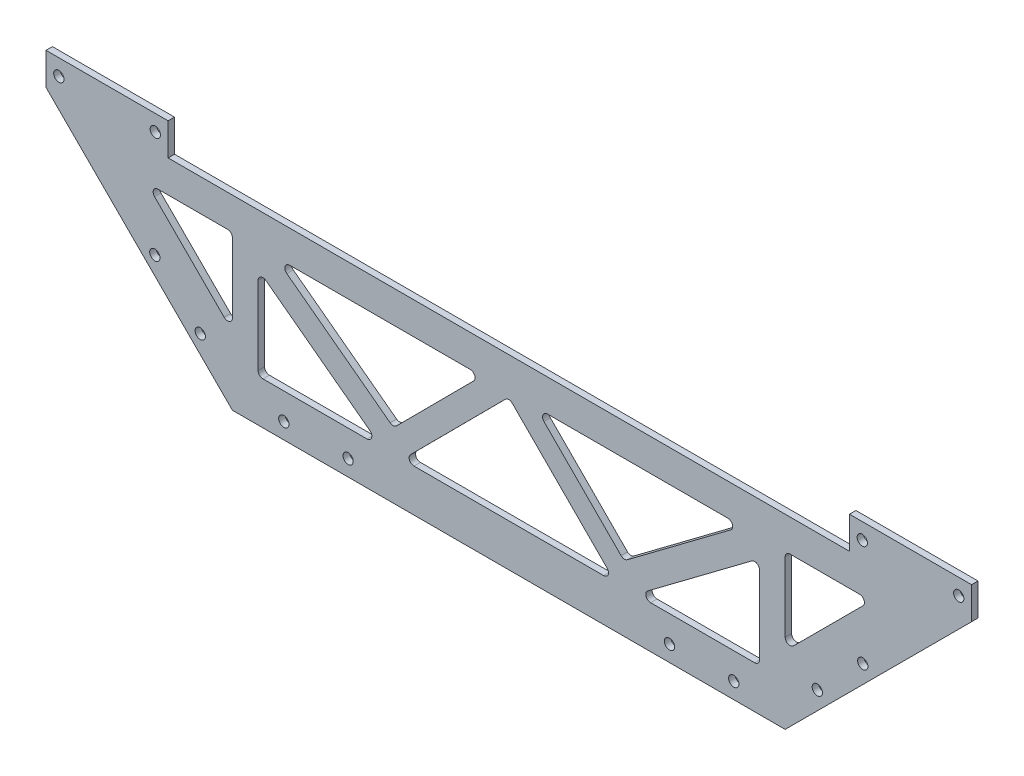
from build123d import *

# Parameters (mm, degrees)
SKETCH_1_R               = 1.6
EXTRUDE_1_DEPTH          = 2
SKETCH_2_R               = 1.6
CUT_EXTRUDE_1_DEPTH      = 156.254629561
SKETCH_3_W               = 288
SKETCH_3_H               = 20
CUT_EXTRUDE_2_DEPTH      = 156.254629561
CUT_EXTRUDE_3_DEPTH      = 156.254629561
CUT_EXTRUDE_3_DEPTH_BACK = 156.254629561


with BuildPart() as part:
    # 草图1 → 凸台-拉伸1 (new body)
    with BuildSketch(Plane.XY):
        Polygon((-106, 30), (-106, 0), (106, 0), (106, 30), (144, 30), (144, 0), (86, -58), (-86, -58), (-144, 0), (-144, 30), align=None)
        with Locations((-140, 25)):
            Circle(SKETCH_1_R, mode=Mode.SUBTRACT)
        with Locations((-110, 25)):
            Circle(SKETCH_1_R, mode=Mode.SUBTRACT)
        with Locations((-110, 5)):
            Circle(SKETCH_1_R, mode=Mode.SUBTRACT)
        with Locations((-140, 5)):
            Circle(SKETCH_1_R, mode=Mode.SUBTRACT)
        with Locations(Location((140, 5, 0), (0, 0, 180))):
            Circle(SKETCH_1_R, mode=Mode.SUBTRACT)
        with Locations(Location((110, 5, 0), (0, 0, 180))):
            Circle(SKETCH_1_R, mode=Mode.SUBTRACT)
        with Locations(Location((110, 25, 0), (0, 0, 180))):
            Circle(SKETCH_1_R, mode=Mode.SUBTRACT)
        with Locations(Location((140, 25, 0), (0, 0, 180))):
            Circle(SKETCH_1_R, mode=Mode.SUBTRACT)
        with Locations((-70, -53)):
            Circle(SKETCH_1_R, mode=Mode.SUBTRACT)
        with Locations((-50, -53)):
            Circle(SKETCH_1_R, mode=Mode.SUBTRACT)
        with Locations(Location((50, -53, 0), (0, 0, 180))):
            Circle(SKETCH_1_R, mode=Mode.SUBTRACT)
        with Locations(Location((70, -53, 0), (0, 0, 180))):
            Circle(SKETCH_1_R, mode=Mode.SUBTRACT)
    extrude(amount=EXTRUDE_1_DEPTH)

    # 草图2 → 切除-拉伸1 (cut, through all)
    with BuildSketch(Plane.XY.offset(2)):
        with Locations((-110.142135624, -28.201010127)):
            Circle(SKETCH_2_R)
        with Locations((-96, -42.343145751)):
            Circle(SKETCH_2_R)
        with Locations(Location((96, -42.343145751, 0), (0, 0, 180))):
            Circle(SKETCH_2_R)
        with Locations(Location((110.142135624, -28.201010127, 0), (0, 0, 180))):
            Circle(SKETCH_2_R)
    extrude(amount=-CUT_EXTRUDE_1_DEPTH, mode=Mode.SUBTRACT)

    # 草图3 → 切除-拉伸2 (cut, through all)
    with BuildSketch(Plane.XY.offset(2)):
        with Locations((0, 20)):
            Rectangle(SKETCH_3_W, SKETCH_3_H)
    extrude(amount=-CUT_EXTRUDE_2_DEPTH, mode=Mode.SUBTRACT)

    # 草图4 → 切除-拉伸3 (cut, two sides: drawn at the far end of the back side and taken through both)
    with BuildSketch(Plane.XY.offset(2).offset(-CUT_EXTRUDE_3_DEPTH_BACK)):
        with BuildLine():
            Line((-110.226136393, -12.560660172), (-88.560660172, -34.226136393))
            ThreePointArc((-88.560660172, -34.226136393), (-86.925974851, -34.55129552), (-86, -33.165476221))
            Line((-86, -33.165476221), (-86, -11.5))
            ThreePointArc((-86, -11.5), (-86.439339828, -10.439339828), (-87.5, -10))
            Line((-87.5, -10), (-109.165476221, -10))
            ThreePointArc((-109.165476221, -10), (-110.55129552, -10.925974851), (-110.226136393, -12.560660172))
        make_face()
        with BuildLine():
            Line((-78, -19), (-78, -43.286796564))
            ThreePointArc((-78, -43.286796564), (-77.560660172, -44.347456736), (-76.5, -44.786796564))
            Line((-76.5, -44.786796564), (-44.117604581, -44.786796564))
            ThreePointArc((-44.117604581, -44.786796564), (-42.694579634, -43.761138213), (-43.217604581, -42.086796564))
            Line((-43.217604581, -42.086796564), (-75.6, -17.8))
            ThreePointArc((-75.6, -17.8), (-77.170820393, -17.658359214), (-78, -19))
        make_face()
        with BuildLine():
            Line((-68.166666667, -10), (-12, -10))
            ThreePointArc((-12, -10), (-10.614927355, -10.924175575), (-10.936588454, -12.557901642))
            Line((-10.936588454, -12.557901642), (-34.936588454, -36.682901642))
            ThreePointArc((-34.936588454, -36.682901642), (-35.891723413, -37.121086956), (-36.9, -36.825))
            Line((-36.9, -36.825), (-69.066666667, -12.7))
            ThreePointArc((-69.066666667, -12.7), (-69.589691614, -11.025658351), (-68.166666667, -10))
        make_face()
        with BuildLine():
            Line((36.9, -36.825), (69.066666667, -12.7))
            ThreePointArc((69.066666667, -12.7), (69.589691614, -11.025658351), (68.166666667, -10))
            Line((68.166666667, -10), (12, -10))
            ThreePointArc((12, -10), (10.614927355, -10.924175575), (10.936588454, -12.557901642))
            Line((10.936588454, -12.557901642), (34.936588454, -36.682901642))
            ThreePointArc((34.936588454, -36.682901642), (35.891723413, -37.121086956), (36.9, -36.825))
        make_face()
        with BuildLine():
            Line((43.217604581, -42.086796564), (75.6, -17.8))
            ThreePointArc((75.6, -17.8), (77.170820393, -17.658359214), (78, -19))
            Line((78, -19), (78, -43.286796564))
            ThreePointArc((78, -43.286796564), (77.560660172, -44.347456736), (76.5, -44.786796564))
            Line((76.5, -44.786796564), (44.117604581, -44.786796564))
            ThreePointArc((44.117604581, -44.786796564), (42.694579634, -43.761138213), (43.217604581, -42.086796564))
        make_face()
        with BuildLine():
            Line((87.5, -10), (109.165476221, -10))
            ThreePointArc((109.165476221, -10), (110.55129552, -10.925974851), (110.226136393, -12.560660172))
            Line((110.226136393, -12.560660172), (88.560660172, -34.226136393))
            ThreePointArc((88.560660172, -34.226136393), (86.925974851, -34.55129552), (86, -33.165476221))
            Line((86, -33.165476221), (86, -11.5))
            ThreePointArc((86, -11.5), (86.439339828, -10.439339828), (87.5, -10))
        make_face()
        with BuildLine():
            Line((-30.579964135, -42.228894923), (-1.063411546, -12.558610289))
            ThreePointArc((-1.063411546, -12.558610289), (0, -12.116511931), (1.063411546, -12.558610289))
            Line((1.063411546, -12.558610289), (30.579964135, -42.228894923))
            ThreePointArc((30.579964135, -42.228894923), (30.901625233, -43.86262099), (29.516552589, -44.786796564))
            Line((29.516552589, -44.786796564), (-29.516552589, -44.786796564))
            ThreePointArc((-29.516552589, -44.786796564), (-30.901625233, -43.86262099), (-30.579964135, -42.228894923))
        make_face()
    extrude(amount=CUT_EXTRUDE_3_DEPTH + CUT_EXTRUDE_3_DEPTH_BACK, mode=Mode.SUBTRACT)


solid = part.part
